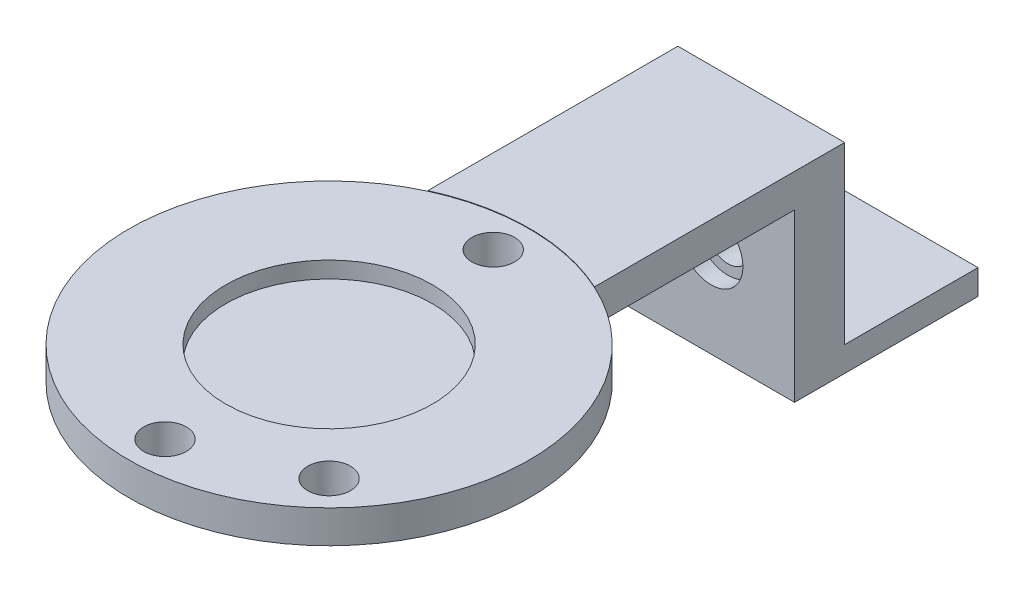
from build123d import *

# Parameters (mm, degrees)
SKETCH1_R           = 30.5
BOSS_EXTRUDE1_DEPTH = 5
SKETCH2_R           = 15.75
CUT_EXTRUDE1_DEPTH  = 2.5
SKETCH3_R           = 15.75
BOSS_EXTRUDE2_DEPTH = 2.5
SKETCH4_R           = 3.25
CUT_EXTRUDE2_DEPTH  = 5.08
SKETCH5_R           = 3.25
CUT_EXTRUDE3_DEPTH  = 5.08
SKETCH6_R           = 3.25
CUT_EXTRUDE4_DEPTH  = 5.08
BOSS_EXTRUDE3_DEPTH = 5.08
SKETCH8_W           = 25.4
SKETCH8_H           = 7.62
BOSS_EXTRUDE4_DEPTH = 25.4
SKETCH9_W           = 25.4
SKETCH9_H           = 3.81
BOSS_EXTRUDE5_DEPTH = 20.32
CUT_EXTRUDE5_DEPTH  = 7.62
SKETCH11_R          = 4.826
CUT_EXTRUDE6_DEPTH  = 2.54


with BuildPart() as part:
    # Sketch1 → Boss-Extrude1 (new body)
    with BuildSketch(Plane(origin=(0, 0, 0), x_dir=(1, 0, 0), z_dir=(0, 1, 0))):
        with Locations(Location((0, 0, 0), (0, 0, 270))):
            Circle(SKETCH1_R)
    extrude(amount=BOSS_EXTRUDE1_DEPTH)

    # Sketch2 → Cut-Extrude1 (cut)
    with BuildSketch(Plane(origin=(0, 5, 0), x_dir=(1, 0, 0), z_dir=(0, 1, 0))):
        with Locations(Location((0, 0, 0), (0, 0, 270))):
            Circle(SKETCH2_R)
    extrude(amount=-CUT_EXTRUDE1_DEPTH, mode=Mode.SUBTRACT)

    # Sketch3 → Boss-Extrude2 (add)
    with BuildSketch(Plane.XZ):
        with Locations(Location((0, 0, 0), (0, 0, 90))):
            Circle(SKETCH3_R)
    extrude(amount=BOSS_EXTRUDE2_DEPTH)

    # Sketch4 → Cut-Extrude2 (cut)
    with BuildSketch(Plane(origin=(0, 0, 0), x_dir=(-1, 0, 0), z_dir=(0, -1, 0))):
        with Locations(Location((0, 25, 0), (0, 0, 90))):
            Circle(SKETCH4_R)
    extrude(amount=-CUT_EXTRUDE2_DEPTH, mode=Mode.SUBTRACT)

    # Sketch5 → Cut-Extrude3 (cut)
    with BuildSketch(Plane.XZ):
        with Locations(Location((0, 25, 0), (0, 0, 270))):
            Circle(SKETCH5_R)
    extrude(amount=-CUT_EXTRUDE3_DEPTH, mode=Mode.SUBTRACT)

    # Sketch6 → Cut-Extrude4 (cut)
    with BuildSketch(Plane.XZ):
        with Locations(Location((17.674476483, 17.680862, 0), (0, 0, 270))):
            Circle(SKETCH6_R)
    extrude(amount=-CUT_EXTRUDE4_DEPTH, mode=Mode.SUBTRACT)

    # Sketch7 → Boss-Extrude3 (add)
    with BuildSketch(Plane.XZ):
        with BuildLine():
            ThreePointArc((12.7, -27.73012802), (6.499272859, -29.79948745), (0, -30.5))
            ThreePointArc((0, -30.5), (-6.499272859, -29.79948745), (-12.7, -27.73012802))
            Line((-12.7, -27.73012802), (-12.7, -65.83012802))
            Line((-12.7, -65.83012802), (12.7, -65.83012802))
            Line((12.7, -65.83012802), (12.7, -27.73012802))
        make_face()
    extrude(amount=-BOSS_EXTRUDE3_DEPTH)

    # Sketch8 → Boss-Extrude4 (add)
    with BuildSketch(Plane.XZ):
        with Locations((0, -62.02012802)):
            Rectangle(SKETCH8_W, SKETCH8_H)
    extrude(amount=BOSS_EXTRUDE4_DEPTH)

    # Sketch9 → Boss-Extrude5 (add)
    with BuildSketch(Plane(origin=(0, 0, -65.83012802), x_dir=(-1, 0, 0), z_dir=(0, 0, -1))):
        with Locations((0, -23.495)):
            Rectangle(SKETCH9_W, SKETCH9_H)
    extrude(amount=BOSS_EXTRUDE5_DEPTH)

    # Sketch10 → Cut-Extrude5 (cut)
    with BuildSketch(Plane(origin=(0, 0, -65.83012802), x_dir=(-1, 0, 0), z_dir=(0, 0, -1))):
        with BuildLine():
            ThreePointArc((0, -8.128), (-3.302, -11.43), (0, -14.732))
            Line((0, -14.732), (0, -8.128))
        make_face()
        with BuildLine():
            Line((0, -8.128), (0, -14.732))
            ThreePointArc((0, -14.732), (2.334866591, -13.764866591), (3.302, -11.43))
            ThreePointArc((3.302, -11.43), (2.334866591, -9.095133409), (0, -8.128))
        make_face()
    extrude(amount=-CUT_EXTRUDE5_DEPTH, mode=Mode.SUBTRACT)

    # Sketch11 → Cut-Extrude6 (cut)
    with BuildSketch(Plane.XY.offset(-58.21012802)):
        with Locations((0, -11.43)):
            Circle(SKETCH11_R)
    extrude(amount=-CUT_EXTRUDE6_DEPTH, mode=Mode.SUBTRACT)


solid = part.part
